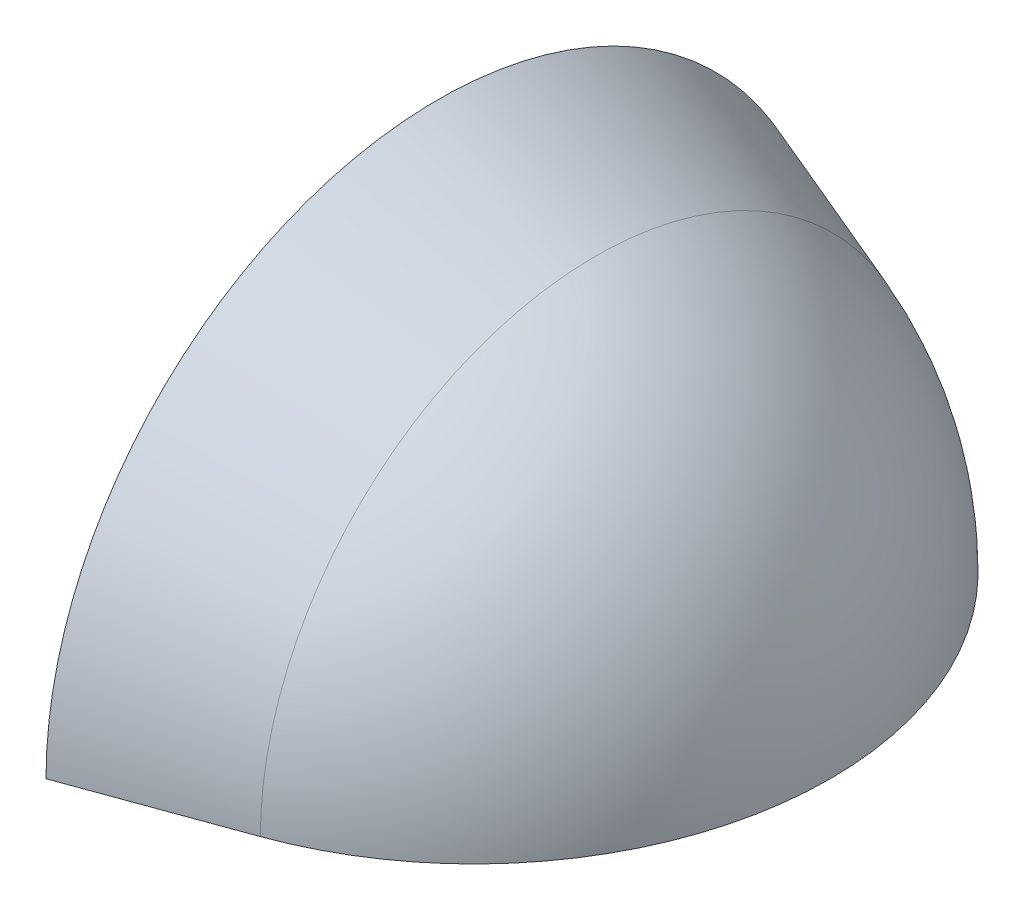
from build123d import *

# Parameters (mm, degrees)
CUT_EXTRUDE5_DEPTH      = 44.994090512
CUT_EXTRUDE5_DEPTH_BACK = 44.994090512
SKETCH2_W               = 90.634629722
SKETCH2_H               = 32.535973662


with BuildPart() as part:
    # Sketch1 → Revolve1 (revolve)
    with BuildSketch(Plane.XY, mode=Mode.PRIVATE) as revolve1_sk:
        with BuildLine():
            Line((-25.4, 0), (-25.4, 25.4))
            Line((-25.4, 25.4), (-15.213718271, 21.704130694))
            ThreePointArc((-15.213718271, 21.704130694), (-4.182206579, 13.252608355), (0, 0))
            Line((0, 0), (-25.4, 0))
        make_face()
    revolve(revolve1_sk.sketch.rotate(Axis((0, 0, 0), (-1, 0, 0)), 180), axis=Axis((0, 0, 0), (-1, 0, 0)))

    # Sketch2 → Cut-Extrude5 (cut, two sides: drawn at the far end of the back side and taken through both)
    with BuildSketch(Plane.XY.offset(-CUT_EXTRUDE5_DEPTH_BACK)):
        with Locations((-37.480055346, -16.267986831)):
            Rectangle(SKETCH2_W, SKETCH2_H)
    extrude(amount=CUT_EXTRUDE5_DEPTH + CUT_EXTRUDE5_DEPTH_BACK, mode=Mode.SUBTRACT)


solid = part.part
